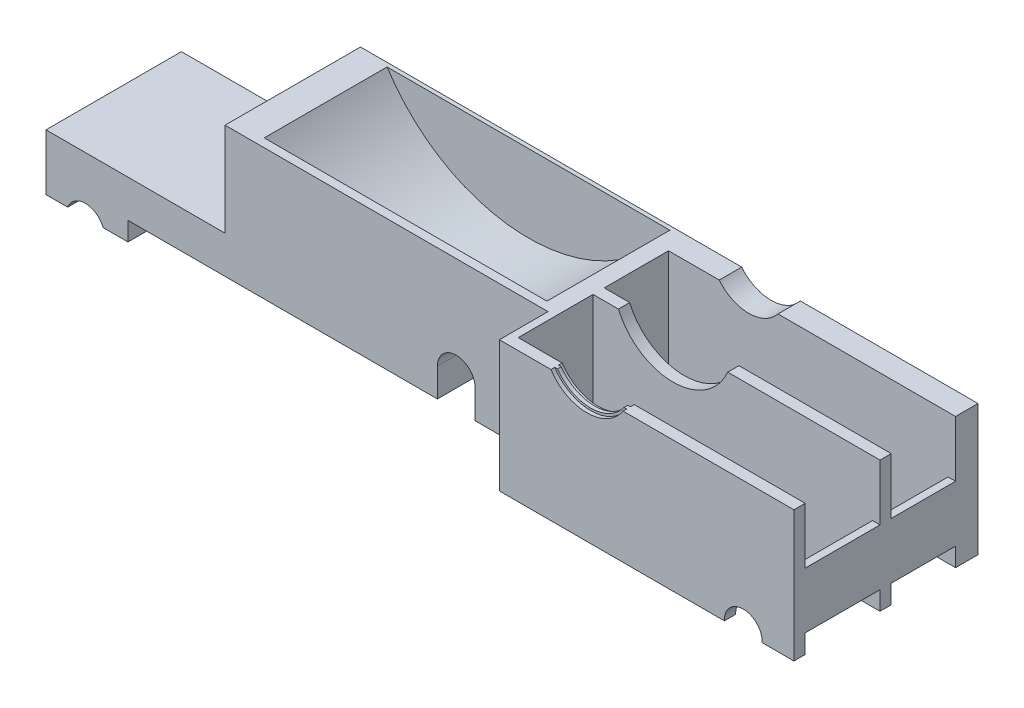
from build123d import *

# Parameters (mm, degrees)
SKETCH1_W           = 419.1
SKETCH1_H           = 142.18412
BOSS_EXTRUDE1_DEPTH = 88.9
SKETCH2_R           = 119.38
CUT_EXTRUDE1_DEPTH  = 83.4009
SKETCH7_W           = 194.780719179
SKETCH7_H           = 43.63974
SKETCH7_H_2         = 50.8
CUT_EXTRUDE2_DEPTH  = 452.402640644
SKETCH4_R           = 40.386
CUT_EXTRUDE4_DEPTH  = 10
SKETCH18_R          = 25.527
CUT_EXTRUDE11_DEPTH = 23.09114
SKETCH5_R           = 27.686
CUT_EXTRUDE5_DEPTH  = 448.05209497
SKETCH8_W           = 419.1
SKETCH8_H           = 88.9
CUT_EXTRUDE6_DEPTH  = 7.85114
SKETCH9_W           = 419.1
SKETCH9_H           = 88.9
CUT_EXTRUDE7_DEPTH  = 11.94308
SKETCH10_W          = 219.202
SKETCH10_H          = 88.9
CUT_EXTRUDE8_DEPTH  = 30.48
SKETCH12_W          = 121.533574186
SKETCH12_H          = 91.9099
BOSS_EXTRUDE2_DEPTH = 25.4
SKETCH14_W          = 55.647095764
SKETCH14_H          = 91.9099
BOSS_EXTRUDE3_DEPTH = 12.7
CUT_EXTRUDE10_REACH = 447.564
SKETCH17_R          = 12.827
BOSS_EXTRUDE4_REACH = 446.193
SKETCH20_W          = 5.08
SKETCH20_H          = 38.1
SKETCH22_W          = 199.898
SKETCH22_H          = 88.9
BOSS_EXTRUDE5_DEPTH = 2.54
SKETCH24_R          = 29.21
CUT_EXTRUDE12_DEPTH = 2.54
CUT_EXTRUDE13_START = -5.08
SKETCH24_4_R        = 29.21
CUT_EXTRUDE13_DEPTH = 2.55016
SKETCH29_R          = 12.827
CUT_EXTRUDE14_DEPTH = 446.564033133
BOSS_EXTRUDE6_DEPTH = 86.10092


with BuildPart() as part:
    # Sketch1 → Boss-Extrude1 (new body)
    with BuildSketch(Plane(origin=(0, 0, 0), x_dir=(1, 0, 0), z_dir=(0, 1, 0))):
        with Locations((209.55, 71.09206)):
            Rectangle(SKETCH1_W, SKETCH1_H)
    extrude(amount=BOSS_EXTRUDE1_DEPTH)

    # Sketch2 → Cut-Extrude1 (cut)
    with BuildSketch(Plane(origin=(0, 0, -131.63296), x_dir=(-1, 0, 0), z_dir=(0, 0, -1))):
        with Locations((-116.7166499, 150.061217688)):
            Circle(SKETCH2_R)
    extrude(amount=-CUT_EXTRUDE1_DEPTH, mode=Mode.SUBTRACT)

    # Sketch7 → Cut-Extrude2 (cut, through all)
    with BuildSketch(Plane(origin=(0, 88.9, 0), x_dir=(1, 0, 0), z_dir=(0, 1, 0))):
        with Locations((321.709640411, 97.27311)):
            Rectangle(SKETCH7_W, SKETCH7_H)
        with Locations((321.709640411, 42.43324)):
            Rectangle(SKETCH7_W, SKETCH7_H_2)
    extrude(amount=-CUT_EXTRUDE2_DEPTH, mode=Mode.SUBTRACT)

    # Sketch4 → Cut-Extrude4 (cut)
    with BuildSketch(Plane(origin=(0, 0, -67.83324), x_dir=(-1, 0, 0), z_dir=(0, 0, -1))):
        with Locations((-278.649352085, 104.852009966)):
            Circle(SKETCH4_R)
    extrude(amount=CUT_EXTRUDE4_DEPTH, mode=Mode.SUBTRACT)

    # Sketch18 → Cut-Extrude11 (cut)
    with BuildSketch(Plane(origin=(0, 0, -142.18412), x_dir=(-1, 0, 0), z_dir=(0, 0, -1))):
        with Locations((-278.649352085, 104.852009966)):
            Circle(SKETCH18_R)
    extrude(amount=-CUT_EXTRUDE11_DEPTH, mode=Mode.SUBTRACT)

    # Sketch5 → Cut-Extrude5 (cut, through all)
    with BuildSketch(Plane(origin=(0, 0, -14.48308), x_dir=(-1, 0, 0), z_dir=(0, 0, -1))):
        with Locations((-278.649352085, 104.852009966)):
            Circle(SKETCH5_R)
    extrude(amount=-CUT_EXTRUDE5_DEPTH, mode=Mode.SUBTRACT)

    # Sketch8 → Cut-Extrude6 (cut)
    with BuildSketch(Plane(origin=(0, 0, -142.18412), x_dir=(-1, 0, 0), z_dir=(0, 0, -1))):
        with Locations((-209.55, 44.45)):
            Rectangle(SKETCH8_W, SKETCH8_H)
    extrude(amount=-CUT_EXTRUDE6_DEPTH, mode=Mode.SUBTRACT)

    # Sketch9 → Cut-Extrude7 (cut)
    with BuildSketch(Plane.XY):
        with Locations((209.55, 44.45)):
            Rectangle(SKETCH9_W, SKETCH9_H)
    extrude(amount=-CUT_EXTRUDE7_DEPTH, mode=Mode.SUBTRACT)

    # Sketch10 → Cut-Extrude8 (cut)
    with BuildSketch(Plane.XY.offset(-11.94308)):
        with Locations((109.601, 44.45)):
            Rectangle(SKETCH10_W, SKETCH10_H)
    extrude(amount=-CUT_EXTRUDE8_DEPTH, mode=Mode.SUBTRACT)

    # Sketch12 → Boss-Extrude2 (add)
    with BuildSketch(Plane.XZ):
        with Locations((-60.766787093, -88.37803)):
            Rectangle(SKETCH12_W, SKETCH12_H)
    extrude(amount=-BOSS_EXTRUDE2_DEPTH)

    # Sketch14 → Boss-Extrude3 (add)
    with BuildSketch(Plane.XZ):
        with Locations((-93.710026304, -88.37803)):
            Rectangle(SKETCH14_W, SKETCH14_H)
    extrude(amount=BOSS_EXTRUDE3_DEPTH)

    # Cut-Extrude10: up to this face of the body (flat: up to its plane)
    cut_extrude10_end = Plane(part.part.faces().sort_by_distance((320.017892525, 43.601141034, -11.94308))[0])
    # Sketch17 → Cut-Extrude10 (cut, up to the picked face)
    with BuildSketch(Plane(origin=(0, 0, -134.33298), x_dir=(-1, 0, 0), z_dir=(0, 0, -1)), mode=Mode.PRIVATE) as cut_extrude10_sk1:
        with Locations((-384.735935495, 0.531880938)):
            Circle(SKETCH17_R)
    cut_extrude10_tool1 = split(extrude(cut_extrude10_sk1.sketch, amount=-CUT_EXTRUDE10_REACH, mode=Mode.PRIVATE), bisect_by=cut_extrude10_end, keep=Keep.BOTH, mode=Mode.PRIVATE)
    # Sketch17 → Cut-Extrude10 (cut, up to the picked face)
    with BuildSketch(Plane(origin=(0, 0, -134.33298), x_dir=(-1, 0, 0), z_dir=(0, 0, -1)), mode=Mode.PRIVATE) as cut_extrude10_sk2:
        with Locations((94.798916194, -17.274045482)):
            Circle(SKETCH17_R)
    cut_extrude10_tool2 = split(extrude(cut_extrude10_sk2.sketch, amount=-CUT_EXTRUDE10_REACH, mode=Mode.PRIVATE), bisect_by=cut_extrude10_end, keep=Keep.BOTH, mode=Mode.PRIVATE)
    # Sketch17 → Cut-Extrude10 (cut, up to the picked face)
    with BuildSketch(Plane(origin=(0, 0, -134.33298), x_dir=(-1, 0, 0), z_dir=(0, 0, -1)), mode=Mode.PRIVATE) as cut_extrude10_sk3:
        with BuildLine():
            Line((-169.736021607, 19.31637742), (-169.736021607, 0))
            Line((-169.736021607, 0), (-144.082021607, 0))
            Line((-144.082021607, 0), (-144.082021607, 19.31637742))
            ThreePointArc((-144.082021607, 19.31637742), (-156.909021607, 32.14337742), (-169.736021607, 19.31637742))
        make_face()
    cut_extrude10_tool3 = split(extrude(cut_extrude10_sk3.sketch, amount=-CUT_EXTRUDE10_REACH, mode=Mode.PRIVATE), bisect_by=cut_extrude10_end, keep=Keep.BOTH, mode=Mode.PRIVATE)
    add(cut_extrude10_tool1.solids().sort_by(Axis((384.735935, 0.531881, -134.33298), (0, 0, 1)))[0], mode=Mode.SUBTRACT)
    add(cut_extrude10_tool2.solids().sort_by(Axis((-94.798916, -17.274045, -134.33298), (0, 0, 1)))[0], mode=Mode.SUBTRACT)
    add(cut_extrude10_tool3.solids().sort_by(Axis((156.909022, 14.834778, -134.33298), (0, 0, 1)))[0], mode=Mode.SUBTRACT)

    # Boss-Extrude4: up to this face of the body (flat: up to its plane)
    boss_extrude4_end = Plane(part.part.faces().sort_by_distance((183.515144796, 41.822372775, -134.33298))[0])
    # Sketch20 → Boss-Extrude4 (add, up to the picked face)
    with BuildSketch(Plane(origin=(0, 0, -17.03324), x_dir=(-1, 0, 0), z_dir=(0, 0, -1)), mode=Mode.PRIVATE) as boss_extrude4_sk1:
        with Locations((-416.56, 31.75)):
            Rectangle(SKETCH20_W, SKETCH20_H)
    boss_extrude4_tool1 = split(extrude(boss_extrude4_sk1.sketch, amount=BOSS_EXTRUDE4_REACH, mode=Mode.PRIVATE), bisect_by=boss_extrude4_end, keep=Keep.BOTH, mode=Mode.PRIVATE)
    add(boss_extrude4_tool1.solids().sort_by(Axis((416.56, 31.75, -17.03324), (0, 0, -1)))[0])

    # Sketch22 → Boss-Extrude5 (add)
    with BuildSketch(Plane.XY.offset(-11.94308)):
        with Locations((319.151, 44.45)):
            Rectangle(SKETCH22_W, SKETCH22_H)
    extrude(amount=BOSS_EXTRUDE5_DEPTH)

    # Sketch24 → Cut-Extrude12 (cut)
    with BuildSketch(Plane.XY.offset(-9.40308)):
        with Locations((278.649352085, 104.852009966)):
            Circle(SKETCH24_R)
    extrude(amount=-CUT_EXTRUDE12_DEPTH, mode=Mode.SUBTRACT)

    # Sketch24<4> → Cut-Extrude13 (cut)
    with BuildSketch(Plane.XY.offset(-9.40308).offset(CUT_EXTRUDE13_START)):
        with Locations((278.649352085, 104.852009966)):
            Circle(SKETCH24_4_R)
    extrude(amount=-CUT_EXTRUDE13_DEPTH, mode=Mode.SUBTRACT)

    # Sketch29 → Cut-Extrude14 (cut, through all)
    with BuildSketch(Plane(origin=(0, 0, -11.94308), x_dir=(-1, 0, 0), z_dir=(0, 0, -1))):
        with Locations((-384.735935495, 0.531880938)):
            Circle(SKETCH29_R)
    extrude(amount=-CUT_EXTRUDE14_DEPTH, mode=Mode.SUBTRACT)

    # Sketch30 → Boss-Extrude6 (add)
    with BuildSketch(Plane(origin=(0, 0, -134.33298), x_dir=(-1, 0, 0), z_dir=(0, 0, -1))):
        with BuildLine():
            Line((-14.194018979, 88.9), (-20.758717893, 88.9))
            ThreePointArc((-20.758717893, 88.9), (-116.7166499, 36.269217688), (-212.674581906, 88.9))
            Line((-212.674581906, 88.9), (-219.239280821, 88.9))
            ThreePointArc((-219.239280821, 88.9), (-116.7166499, 30.681217688), (-14.194018979, 88.9))
        make_face()
    extrude(amount=-BOSS_EXTRUDE6_DEPTH)


solid = part.part
